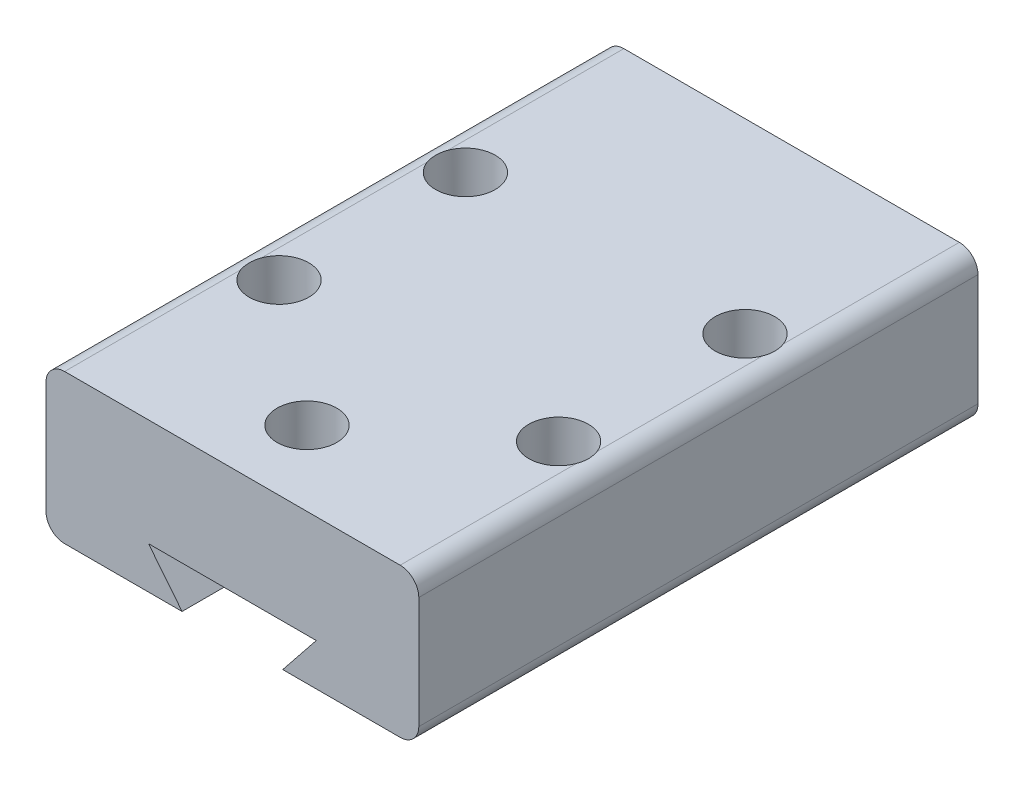
from build123d import *

# Parameters (mm, degrees)
EXTRUDE_1_DEPTH     = 30
FILLET_1_R          = 1
SKETCH_3_R          = 1.6
CUT_EXTRUDE_1_DEPTH = 4


with BuildPart() as part:
    # 草图1 → 凸台-拉伸1 (new body)
    with BuildSketch(Plane.XY):
        Polygon((-34.18476969, 24.74285776), (-14.18476969, 24.74285776), (-14.18476969, 16.74285776), (-21.48476969, 16.74285776), (-19.68476969, 18.99285776), (-28.68476969, 18.99285776), (-26.88476969, 16.74285776), (-34.18476969, 16.74285776), align=None)
    extrude(amount=EXTRUDE_1_DEPTH)

    # 圆角1
    fillet_1_edges = [part.edges().sort_by_distance(p)[0] for p in [
        (-34.18476969, 24.74285776, 15),
        (-14.18476969, 24.74285776, 15),
        (-14.18476969, 16.74285776, 15),
        (-34.18476969, 16.74285776, 15),
    ]]
    fillet(fillet_1_edges, radius=FILLET_1_R)

    # 草图3 → 切除-拉伸1 (cut)
    with BuildSketch(Plane(origin=(0, 24.74285776, 0), x_dir=(1, 0, 0), z_dir=(0, 1, 0))):
        with Locations(Location((-31.68476969, -10, 0), (0, 0, 270))):
            Circle(SKETCH_3_R)
        with Locations(Location((-31.68476969, -20, 0), (0, 0, 270))):
            Circle(SKETCH_3_R)
        with Locations(Location((-16.68476969, -10, 0), (0, 0, 270))):
            Circle(SKETCH_3_R)
        with Locations(Location((-16.68476969, -20, 0), (0, 0, 270))):
            Circle(SKETCH_3_R)
        with Locations(Location((-24.18476969, -26, 0), (0, 0, 270))):
            Circle(SKETCH_3_R)
    extrude(amount=-CUT_EXTRUDE_1_DEPTH, mode=Mode.SUBTRACT)


solid = part.part
